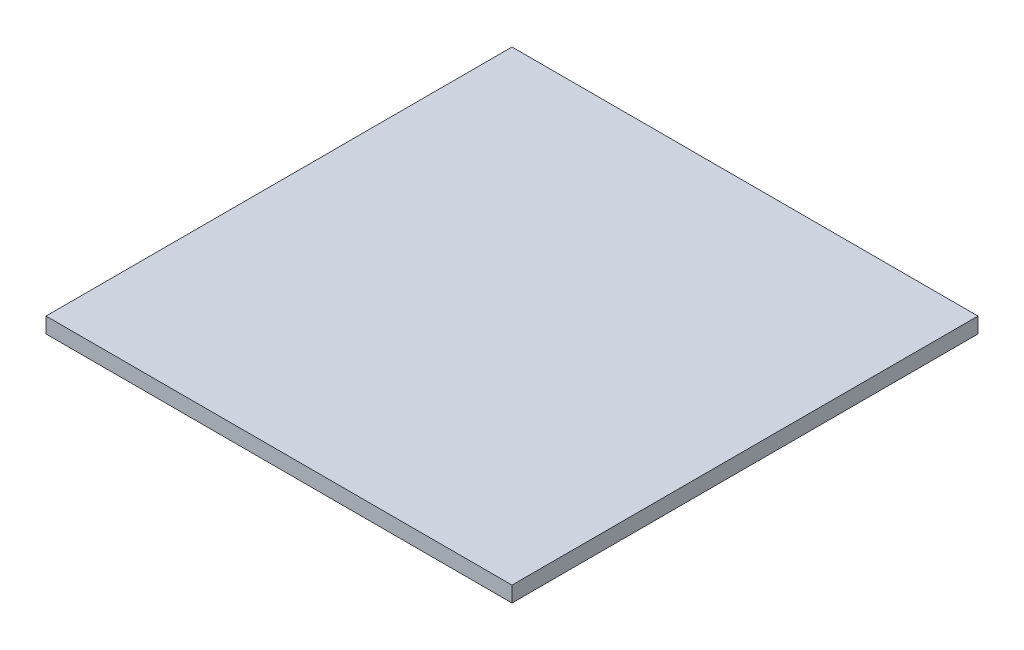
from build123d import *

# Parameters (mm, degrees)
SKIZZE1_W                       = 30000
SKIZZE1_H                       = 30000
AUFSATZ_LINEAR_AUSTRAGEN1_DEPTH = 1000


with BuildPart() as part:
    # Skizze1 → Aufsatz-Linear austragen1 (new body)
    with BuildSketch(Plane(origin=(0, 0, 0), x_dir=(1, 0, 0), z_dir=(0, 1, 0))):
        with Locations((-13276.441531607, -13830.882352941)):
            Rectangle(SKIZZE1_W, SKIZZE1_H)
    extrude(amount=AUFSATZ_LINEAR_AUSTRAGEN1_DEPTH)


solid = part.part
